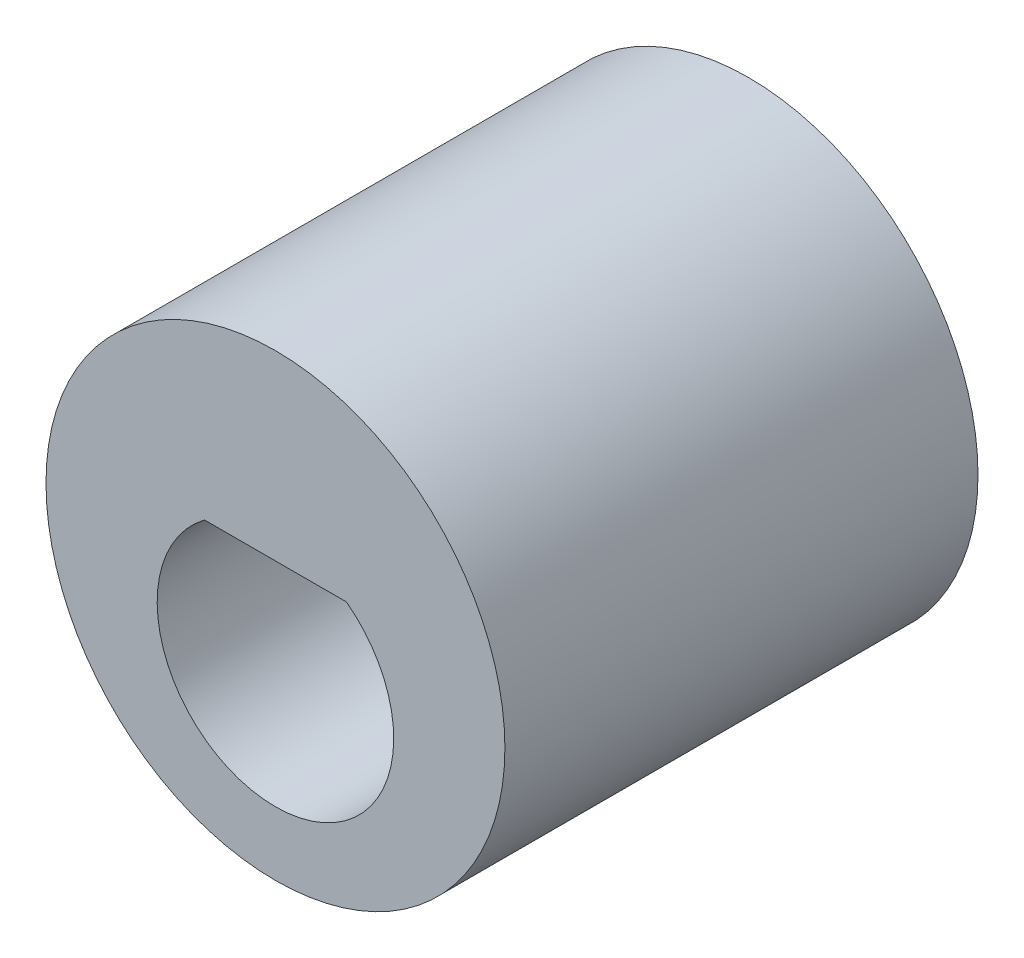
from build123d import *

# Parameters (mm, degrees)
ESQUISSE1_R        = 4.85
BOSS_EXTRU_1_DEPTH = 10


with BuildPart() as part:
    # Esquisse1 → Boss.-Extru.1 (new body)
    with BuildSketch(Plane.XY):
        with Locations((0, 1)):
            Circle(ESQUISSE1_R)
        with BuildLine():
            Line((-1.5, 2), (1.5, 2))
            ThreePointArc((1.5, 2), (0, -2.5), (-1.5, 2))
        make_face(mode=Mode.SUBTRACT)
    extrude(amount=BOSS_EXTRU_1_DEPTH)


solid = part.part
